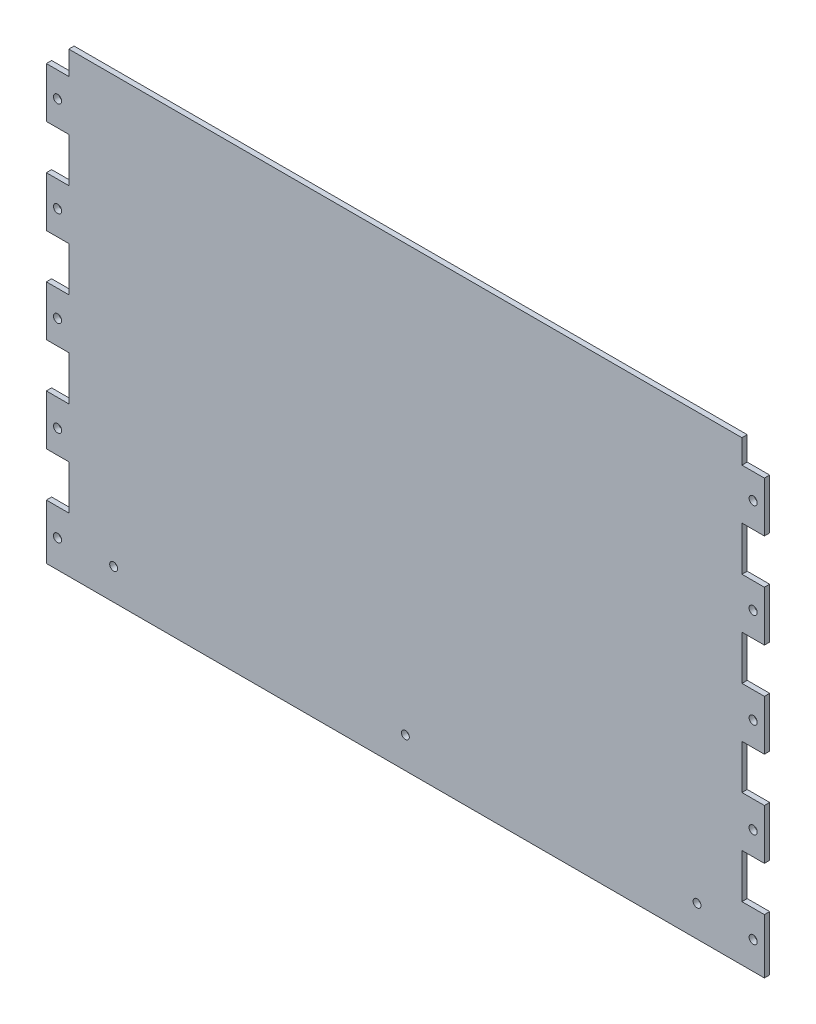
from build123d import *

# Parameters (mm, degrees)
SKETCH1_R           = 1.55
SKETCH1_R_2         = 1.5
BOSS_EXTRUDE1_DEPTH = 2


with BuildPart() as part:
    # Sketch1 → Boss-Extrude1 (new body)
    with BuildSketch(Plane.XY):
        Polygon((0, 20.8), (8.5, 20.8), (8.5, 37.6), (0, 37.6), (0, 56.6), (8.5, 56.6), (8.5, 73.4), (0, 73.4), (0, 92.4), (8.5, 92.4), (8.5, 109.2), (0, 109.2), (0, 128.2), (8.5, 128.2), (8.5, 145), (0, 145), (0, 164), (8.5, 164), (8.5, 173), (263.5, 173), (263.5, 164), (272, 164), (272, 145), (263.5, 145), (263.5, 128.2), (272, 128.2), (272, 109.2), (263.5, 109.2), (263.5, 92.4), (272, 92.4), (272, 73.4), (263.5, 73.4), (263.5, 56.6), (272, 56.6), (272, 37.6), (263.5, 37.6), (263.5, 20.8), (272, 20.8), (272, 0), (0, 0), align=None)
        with Locations((4.25, 154.5)):
            Circle(SKETCH1_R, mode=Mode.SUBTRACT)
        with Locations((4.25, 118.5)):
            Circle(SKETCH1_R, mode=Mode.SUBTRACT)
        with Locations((4.25, 82.5)):
            Circle(SKETCH1_R, mode=Mode.SUBTRACT)
        with Locations((4.25, 46.5)):
            Circle(SKETCH1_R, mode=Mode.SUBTRACT)
        with Locations((4.25, 10.5)):
            Circle(SKETCH1_R, mode=Mode.SUBTRACT)
        with Locations(Location((267.75, 10.5, 0), (0, 0, 180))):
            Circle(SKETCH1_R, mode=Mode.SUBTRACT)
        with Locations(Location((267.75, 46.5, 0), (0, 0, 180))):
            Circle(SKETCH1_R, mode=Mode.SUBTRACT)
        with Locations(Location((267.75, 82.5, 0), (0, 0, 180))):
            Circle(SKETCH1_R, mode=Mode.SUBTRACT)
        with Locations(Location((267.75, 118.5, 0), (0, 0, 180))):
            Circle(SKETCH1_R, mode=Mode.SUBTRACT)
        with Locations(Location((267.75, 154.5, 0), (0, 0, 180))):
            Circle(SKETCH1_R, mode=Mode.SUBTRACT)
        with Locations((25.5, 11.75)):
            Circle(SKETCH1_R_2, mode=Mode.SUBTRACT)
        with Locations((136, 11.75)):
            Circle(SKETCH1_R_2, mode=Mode.SUBTRACT)
        with Locations((246.5, 11.75)):
            Circle(SKETCH1_R_2, mode=Mode.SUBTRACT)
    extrude(amount=BOSS_EXTRUDE1_DEPTH)


solid = part.part
